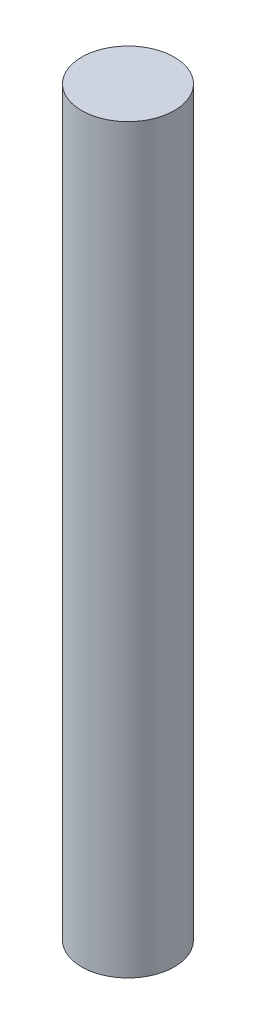
from build123d import *

# Parameters (mm, degrees)
SKETCH1_R           = 1.5875
BOSS_EXTRUDE1_DEPTH = 25.4


with BuildPart() as part:
    # Sketch1 → Boss-Extrude1 (new body)
    with BuildSketch(Plane(origin=(0, 0, 0), x_dir=(1, 0, 0), z_dir=(0, 1, 0))):
        with Locations(Location((0, 0, 0), (0, 0, 270))):
            Circle(SKETCH1_R)
    extrude(amount=BOSS_EXTRUDE1_DEPTH)


solid = part.part
